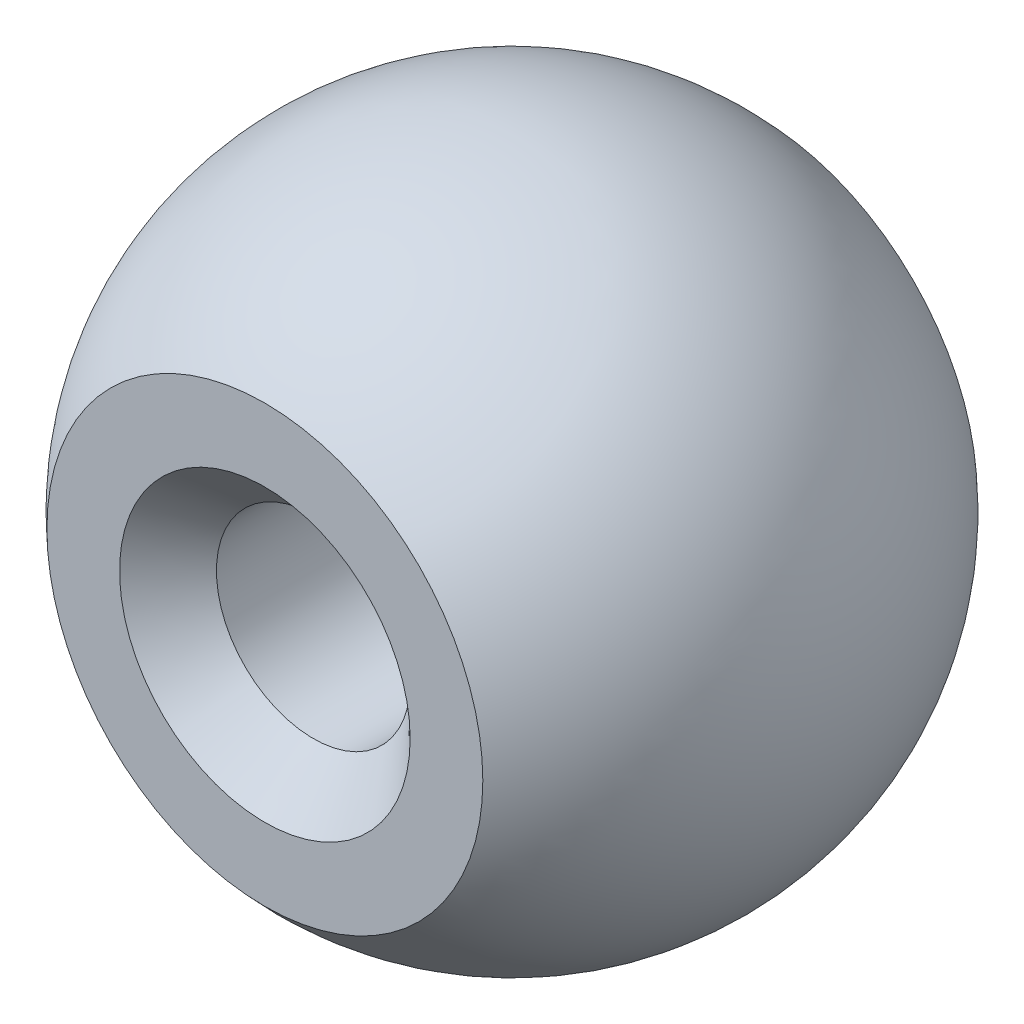
from build123d import *

# Parameters (mm, degrees)
CSK_FOR_M1_6_COUNTERSUNK_FLAT_HEAD_SCREW_D           = 4
CSK_FOR_M1_6_COUNTERSUNK_FLAT_HEAD_SCREW_CSINK_D     = 6
CSK_FOR_M1_6_COUNTERSUNK_FLAT_HEAD_SCREW_CSINK_ANGLE = 90


with BuildPart() as part:
    # Sketch1 → Revolve1 (revolve)
    with BuildSketch(Plane(origin=(0, 0, 0), x_dir=(1, 0, 0), z_dir=(0, 1, 0))):
        with BuildLine():
            Line((0, -5.102520386), (0, 5.102520386))
            Line((0, 5.102520386), (4.5, 5.102520386))
            ThreePointArc((4.5, 5.102520386), (6.803360514, 0), (4.5, -5.102520386))
            Line((4.5, -5.102520386), (0, -5.102520386))
        make_face()
    revolve(axis=Axis((0, 0, 5.102520386), (0, 0, -1)))

    # CSK for M1.6 Countersunk Flat Head Screw1 (through all)
    with Locations(Plane.XY.offset(5.102520386)):
        with Locations((0, 0)):
            CounterSinkHole(CSK_FOR_M1_6_COUNTERSUNK_FLAT_HEAD_SCREW_D / 2, CSK_FOR_M1_6_COUNTERSUNK_FLAT_HEAD_SCREW_CSINK_D / 2, counter_sink_angle=CSK_FOR_M1_6_COUNTERSUNK_FLAT_HEAD_SCREW_CSINK_ANGLE)


solid = part.part
